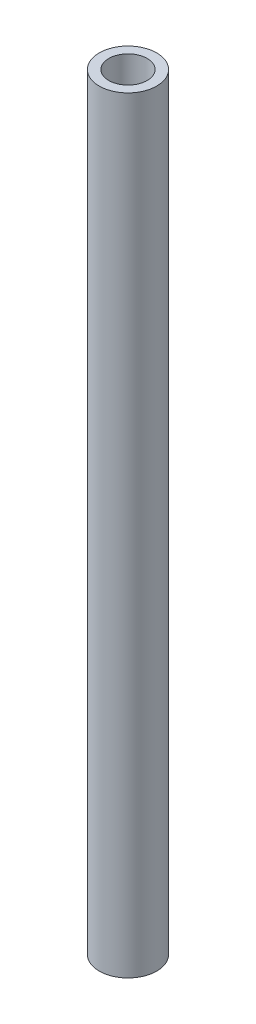
from build123d import *

# Parameters (mm, degrees)
SKETCH1_R           = 3.81
SKETCH1_R_2         = 2.54
BOSS_EXTRUDE1_DEPTH = 101.6


with BuildPart() as part:
    # Sketch1 → Boss-Extrude1 (new body)
    with BuildSketch(Plane(origin=(0, 0, 0), x_dir=(1, 0, 0), z_dir=(0, 1, 0))):
        with Locations(Location((0, 0, 0), (0, 0, 270))):
            Circle(SKETCH1_R)
        with Locations(Location((0, 0, 0), (0, 0, 270))):
            Circle(SKETCH1_R_2, mode=Mode.SUBTRACT)
    extrude(amount=BOSS_EXTRUDE1_DEPTH)


solid = part.part
